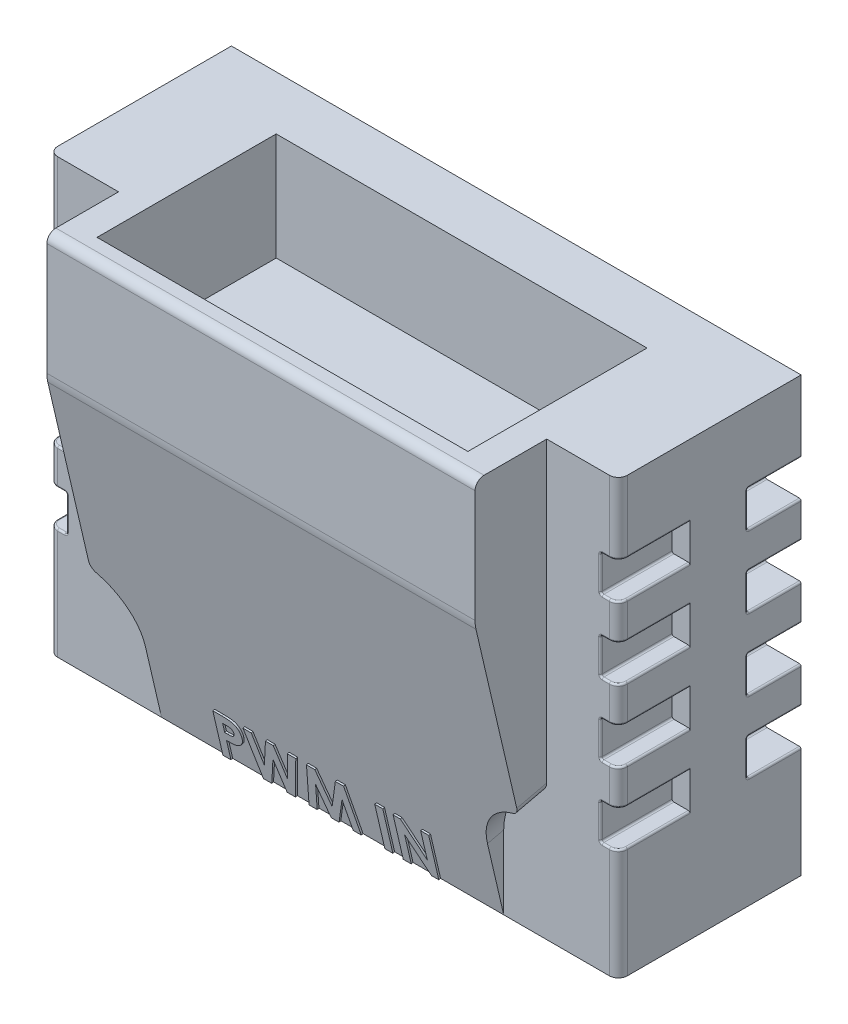
from build123d import *

# Parameters (mm, degrees)
SKETCH1_W           = 31.8
SKETCH1_H           = 24.2
BOSS_EXTRUDE1_DEPTH = 5.1
BOSS_EXTRUDE2_START = -4
BOSS_EXTRUDE2_DEPTH = 23.9
FILLET1_R           = 2
FILLET2_R           = 0.5
CUT_EXTRUDE1_REACH  = 26.566
FILLET4_R           = 0.5
SKETCH5_W           = 1
SKETCH5_H           = 2
CUT_EXTRUDE2_DEPTH  = 4
FILLET5_R           = 0.5
FILLET6_R           = 0.1
FILLET7_R           = 0.1
SKETCH6_W           = 20.7
SKETCH6_H           = 10
CUT_EXTRUDE3_DEPTH  = 6
SKETCH7_W           = 2
SKETCH7_H           = 2
CUT_EXTRUDE4_DEPTH  = 3
FILLET8_R           = 0.1
SKETCH9_W           = 16.6
SKETCH9_H           = 4.4
CUT_EXTRUDE5_DEPTH  = 3
SKETCH10_W          = 0.448717949
SKETCH10_H          = 2.5
BOSS_EXTRUDE3_DEPTH = 0.1


with BuildPart() as part:
    # Sketch1 → Boss-Extrude1 (new, symmetric)
    with BuildSketch(Plane.XY):
        Rectangle(SKETCH1_W, SKETCH1_H)
    extrude(amount=BOSS_EXTRUDE1_DEPTH, both=True)

    # Sketch3 → Boss-Extrude2 (add)
    with BuildSketch(Plane(origin=(15.9, 0, 0), x_dir=(0, 0, -1), z_dir=(1, 0, 0)).offset(BOSS_EXTRUDE2_START)):
        Polygon((-5.1, -12.1), (-5.798193173, -9.097769357), (-9.1, 5.1), (-9.1, 12.1), (-5.1, 12.1), align=None)
    extrude(amount=-BOSS_EXTRUDE2_DEPTH)

    # Fillet1
    fillet1_edges = [part.edges().sort_by_distance(p)[0] for p in [
        (-0.05, 5.1, 9.1),
    ]]
    fillet(fillet1_edges, radius=FILLET1_R)

    # Fillet2
    fillet2_edges = [part.edges().sort_by_distance(p)[0] for p in [
        (-0.05, 12.1, 9.1),
    ]]
    fillet(fillet2_edges, radius=FILLET2_R)

    # Cut-Extrude1: up to this face of the body (flat: up to its plane)
    cut_extrude1_end = Plane(part.part.faces().sort_by_distance((-13.95, 0, 5.1))[0])
    # Sketch4 → Cut-Extrude1 (cut, up to the picked face)
    with BuildSketch(Plane(origin=(0, -1.746023602, 7.507901488), x_dir=(1, 0, 0), z_dir=(0, -0.22651349466027812, 0.9740080270391966)), mode=Mode.PRIVATE) as cut_extrude1_sk1:
        with BuildLine():
            Line((-9.6, -6.630278304), (-9.6, -10.630278304))
            Line((-9.6, -10.630278304), (-12, -10.630278304))
            Line((-12, -10.630278304), (-12, -3.630278304))
            ThreePointArc((-12, -3.630278304), (-10.273828411, -4.709341033), (-9.6, -6.630278304))
        make_face()
    cut_extrude1_tool1 = split(extrude(cut_extrude1_sk1.sketch, amount=-CUT_EXTRUDE1_REACH, mode=Mode.PRIVATE), bisect_by=cut_extrude1_end, keep=Keep.BOTH, mode=Mode.PRIVATE)
    # Sketch4 → Cut-Extrude1 (cut, up to the picked face)
    with BuildSketch(Plane(origin=(0, -1.746023602, 7.507901488), x_dir=(1, 0, 0), z_dir=(0, -0.22651349466027812, 0.9740080270391966)), mode=Mode.PRIVATE) as cut_extrude1_sk2:
        with BuildLine():
            Line((9.5, -6.630278304), (9.5, -10.630278304))
            Line((9.5, -10.630278304), (11.9, -10.630278304))
            Line((11.9, -10.630278304), (11.9, -3.630278304))
            ThreePointArc((11.9, -3.630278304), (10.173828411, -4.709341033), (9.5, -6.630278304))
        make_face()
    cut_extrude1_tool2 = split(extrude(cut_extrude1_sk2.sketch, amount=-CUT_EXTRUDE1_REACH, mode=Mode.PRIVATE), bisect_by=cut_extrude1_end, keep=Keep.BOTH, mode=Mode.PRIVATE)
    add(cut_extrude1_tool1.solids().sort_by(Axis((-10.871103, -9.027029, 5.814644), (0, 0.22651349466027812, -0.9740080270391966)))[0], mode=Mode.SUBTRACT)
    add(cut_extrude1_tool2.solids().sort_by(Axis((10.771103, -9.027029, 5.814644), (0, 0.22651349466027812, -0.9740080270391966)))[0], mode=Mode.SUBTRACT)

    # Fillet4
    fillet4_edges = [part.edges().sort_by_distance(p)[0] for p in [
        (11.9, -5.097572362, 5.892797231),
        (-12, -5.097572362, 5.892797231),
    ]]
    fillet(fillet4_edges, radius=FILLET4_R)

    # Sketch5 → Cut-Extrude2 (cut)
    with BuildSketch(Plane.XY.offset(5.1)):
        with Locations((-15.4, -0.9)):
            Rectangle(SKETCH5_W, SKETCH5_H)
        with Locations((-15.4, -4.9)):
            Rectangle(SKETCH5_W, SKETCH5_H)
        with Locations((-15.4, 7.1)):
            Rectangle(SKETCH5_W, SKETCH5_H)
        with Locations((15.4, 7.1)):
            Rectangle(SKETCH5_W, SKETCH5_H)
        with Locations((15.4, 3.1)):
            Rectangle(SKETCH5_W, SKETCH5_H)
        with Locations((15.4, -0.9)):
            Rectangle(SKETCH5_W, SKETCH5_H)
        with Locations((15.4, -4.9)):
            Rectangle(SKETCH5_W, SKETCH5_H)
        with Locations((-15.4, 3.1)):
            Rectangle(SKETCH5_W, SKETCH5_H)
    extrude(amount=-CUT_EXTRUDE2_DEPTH, mode=Mode.SUBTRACT)

    # Fillet5
    fillet5_edges = [part.edges().sort_by_distance(p)[0] for p in [
        (15.9, -9, 5.1),
        (-15.9, 10.1, 5.1),
        (15.9, -2.9, 5.1),
        (15.9, 1.1, 5.1),
        (15.9, 5.1, 5.1),
        (15.9, 10.1, 5.1),
        (-15.9, 5.1, 5.1),
        (-15.9, 1.1, 5.1),
        (-15.9, -2.9, 5.1),
        (-15.9, -9, 5.1),
    ]]
    fillet(fillet5_edges, radius=FILLET5_R)

    # Fillet6
    fillet6_edges = [part.edges().sort_by_distance(p)[0] for p in [
        (14.9, 8.1, 3.1),
        (15.9, 8.1, 2.85),
        (15.9, 6.1, 2.85),
        (14.9, 6.1, 3.1),
        (14.9, 7.1, 5.1),
        (14.9, 4.1, 3.1),
        (15.9, 4.1, 2.85),
        (15.9, 2.1, 2.85),
        (14.9, 2.1, 3.1),
        (14.9, 3.1, 5.1),
        (14.9, 0.1, 3.1),
        (15.9, 0.1, 2.85),
        (15.9, -1.9, 2.85),
        (14.9, -1.9, 3.1),
        (14.9, -0.9, 5.1),
        (14.9, -3.9, 3.1),
        (15.9, -3.9, 2.85),
        (15.9, -5.9, 2.85),
        (14.9, -5.9, 3.1),
        (14.9, -4.9, 5.1),
        (15.15, 8.1, 5.1),
        (15.15, -5.9, 5.1),
        (15.15, -3.9, 5.1),
        (15.15, -1.9, 5.1),
        (15.15, 0.1, 5.1),
        (15.15, 2.1, 5.1),
        (15.15, 4.1, 5.1),
        (15.15, 6.1, 5.1),
        (15.753553391, -5.9, 4.953553391),
        (15.753553391, -1.9, 4.953553391),
        (15.753553391, -3.9, 4.953553391),
        (15.753553391, 2.1, 4.953553391),
        (15.753553391, 0.1, 4.953553391),
        (15.753553391, 6.1, 4.953553391),
        (15.753553391, 4.1, 4.953553391),
        (15.753553391, 8.1, 4.953553391),
    ]]
    fillet(fillet6_edges, radius=FILLET6_R)

    # Fillet7
    fillet7_edges = [part.edges().sort_by_distance(p)[0] for p in [
        (-15.9, -3.9, 2.85),
        (-14.9, -4.9, 5.1),
        (-14.9, -3.9, 3.1),
        (-14.9, -5.9, 3.1),
        (-15.9, -5.9, 2.85),
        (-15.9, 8.1, 2.85),
        (-14.9, 7.1, 5.1),
        (-14.9, 8.1, 3.1),
        (-14.9, 6.1, 3.1),
        (-15.9, 6.1, 2.85),
        (-15.9, 4.1, 2.85),
        (-14.9, 3.1, 5.1),
        (-14.9, 4.1, 3.1),
        (-14.9, 2.1, 3.1),
        (-15.9, 2.1, 2.85),
        (-15.9, 0.1, 2.85),
        (-14.9, -0.9, 5.1),
        (-14.9, 0.1, 3.1),
        (-14.9, -1.9, 3.1),
        (-15.9, -1.9, 2.85),
        (-15.15, -3.9, 5.1),
        (-15.15, -5.9, 5.1),
        (-15.15, 8.1, 5.1),
        (-15.15, 6.1, 5.1),
        (-15.15, 4.1, 5.1),
        (-15.15, 2.1, 5.1),
        (-15.15, 0.1, 5.1),
        (-15.15, -1.9, 5.1),
        (-15.753553391, -5.9, 4.953553391),
        (-15.753553391, -3.9, 4.953553391),
        (-15.753553391, -1.9, 4.953553391),
        (-15.753553391, 0.1, 4.953553391),
        (-15.753553391, 2.1, 4.953553391),
        (-15.753553391, 4.1, 4.953553391),
        (-15.753553391, 6.1, 4.953553391),
        (-15.753553391, 8.1, 4.953553391),
    ]]
    fillet(fillet7_edges, radius=FILLET7_R)

    # Sketch6 → Cut-Extrude3 (cut)
    with BuildSketch(Plane(origin=(0, 12.1, 0), x_dir=(1, 0, 0), z_dir=(0, 1, 0))):
        with Locations((-0.05, -2.9)):
            Rectangle(SKETCH6_W, SKETCH6_H)
    extrude(amount=-CUT_EXTRUDE3_DEPTH, mode=Mode.SUBTRACT)

    # Sketch7 → Cut-Extrude4 (cut)
    with BuildSketch(Plane(origin=(0, 0, -5.1), x_dir=(-1, 0, 0), z_dir=(0, 0, -1))):
        with Locations((-14.9, 7.1)):
            Rectangle(SKETCH7_W, SKETCH7_H)
        with Locations((-14.9, 3.1)):
            Rectangle(SKETCH7_W, SKETCH7_H)
        with Locations((-14.9, -0.9)):
            Rectangle(SKETCH7_W, SKETCH7_H)
        with Locations((-14.9, -4.9)):
            Rectangle(SKETCH7_W, SKETCH7_H)
        with Locations((14.9, -4.9)):
            Rectangle(SKETCH7_W, SKETCH7_H)
        with Locations((14.9, -0.9)):
            Rectangle(SKETCH7_W, SKETCH7_H)
        with Locations((14.9, 3.1)):
            Rectangle(SKETCH7_W, SKETCH7_H)
        with Locations((14.9, 7.1)):
            Rectangle(SKETCH7_W, SKETCH7_H)
    extrude(amount=-CUT_EXTRUDE4_DEPTH, mode=Mode.SUBTRACT)

    # Fillet8
    fillet8_edges = [part.edges().sort_by_distance(p)[0] for p in [
        (15.9, 3.1, -2.1),
        (15.9, 2.1, -3.6),
        (14.9, 4.1, -2.1),
        (15.9, 4.1, -3.6),
        (13.9, 4.1, -3.6),
        (14.9, 2.1, -2.1),
        (13.9, 2.1, -3.6),
        (15.9, -0.9, -2.1),
        (15.9, -1.9, -3.6),
        (14.9, 0.1, -2.1),
        (15.9, 0.1, -3.6),
        (13.9, 0.1, -3.6),
        (14.9, -1.9, -2.1),
        (13.9, -1.9, -3.6),
        (15.9, -4.9, -2.1),
        (15.9, -5.9, -3.6),
        (14.9, -3.9, -2.1),
        (15.9, -3.9, -3.6),
        (13.9, -3.9, -3.6),
        (14.9, -5.9, -2.1),
        (13.9, -5.9, -3.6),
        (-15.9, -4.9, -2.1),
        (-15.9, -3.9, -3.6),
        (-14.9, -5.9, -2.1),
        (-15.9, -5.9, -3.6),
        (-13.9, -5.9, -3.6),
        (-14.9, -3.9, -2.1),
        (-13.9, -3.9, -3.6),
        (-15.9, -0.9, -2.1),
        (-15.9, 0.1, -3.6),
        (-14.9, -1.9, -2.1),
        (-15.9, -1.9, -3.6),
        (-13.9, -1.9, -3.6),
        (-14.9, 0.1, -2.1),
        (-13.9, 0.1, -3.6),
        (-15.9, 3.1, -2.1),
        (-15.9, 4.1, -3.6),
        (-14.9, 2.1, -2.1),
        (-15.9, 2.1, -3.6),
        (-13.9, 2.1, -3.6),
        (-14.9, 4.1, -2.1),
        (-13.9, 4.1, -3.6),
        (-15.9, 7.1, -2.1),
        (-15.9, 8.1, -3.6),
        (-14.9, 6.1, -2.1),
        (-15.9, 6.1, -3.6),
        (-13.9, 6.1, -3.6),
        (-14.9, 8.1, -2.1),
        (-13.9, 8.1, -3.6),
        (15.9, 7.1, -2.1),
        (15.9, 6.1, -3.6),
        (14.9, 8.1, -2.1),
        (15.9, 8.1, -3.6),
        (13.9, 8.1, -3.6),
        (14.9, 6.1, -2.1),
        (13.9, 6.1, -3.6),
    ]]
    fillet(fillet8_edges, radius=FILLET8_R)

    # Sketch9 → Cut-Extrude5 (cut)
    with BuildSketch(Plane.XZ.offset(12.1)):
        with Locations((0, 1.6)):
            Rectangle(SKETCH9_W, SKETCH9_H)
    extrude(amount=-CUT_EXTRUDE5_DEPTH, mode=Mode.SUBTRACT)

    # Sketch10 → Boss-Extrude3 (add)
    # profile 1 of 5: a face of its own
    with BuildSketch(Plane(origin=(0, -1.746023602, 7.507901488), x_dir=(1, 0, 0), z_dir=(0, -0.22651349466027812, 0.9740080270391966))):
        with BuildLine():
            Line((-6.075641026, -8.130278304), (-5.574839744, -8.130278304))
            add(Edge.make_bspline(
                [(-5.574839744, -8.130278304), (-5.542118038, -8.130424774), (-5.478991008, -8.130707344), (-5.387956637, -8.134133881), (-5.303972972, -8.140274445), (-5.227059309, -8.147863211), (-5.157247273, -8.158502365), (-5.094449438, -8.170699322), (-5.038652771, -8.185558766), (-4.989228084, -8.20319672), (-4.944871023, -8.223991178), (-4.902894937, -8.246138761), (-4.864248489, -8.272571119), (-4.826981078, -8.300439487), (-4.793223346, -8.332406118), (-4.760869282, -8.366343586), (-4.731289169, -8.403597823), (-4.704345945, -8.443717878), (-4.679904289, -8.485962503), (-4.658550423, -8.530407219), (-4.641229363, -8.577122354), (-4.626699148, -8.625805716), (-4.615028337, -8.676455182), (-4.607259874, -8.729382252), (-4.601983143, -8.784217368), (-4.601517544, -8.821538182), (-4.601282051, -8.840414522)],
                knots=[0, 0, 0, 0, 1.698747864, 3.27724071, 4.728299578, 6.070144658, 7.288476769, 8.393259625, 9.389771311, 10.283485332, 11.113357557, 11.931608583, 12.74405601, 13.541433047, 14.344816069, 15.154114104, 15.974336324, 16.810834471, 17.661136416, 18.50621059, 19.367396281, 20.244825668, 21.142564693, 22.063065223, 23.020325768, 24, 24, 24, 24], degree=3))
            add(Edge.make_bspline(
                [(-4.601282051, -8.840414522), (-4.60162278, -8.861296968), (-4.602292355, -8.902333541), (-4.608856345, -8.962488121), (-4.620069715, -9.019840067), (-4.634725002, -9.074873038), (-4.655160757, -9.12668162), (-4.678507648, -9.176501981), (-4.707231729, -9.222937311), (-4.740053584, -9.26656846), (-4.775898794, -9.307750171), (-4.815618323, -9.345293398), (-4.8584551, -9.379454074), (-4.904161157, -9.410590204), (-4.952908089, -9.43863898), (-5.004660723, -9.463863049), (-5.059772455, -9.485455667), (-5.098150607, -9.496748432), (-5.117608173, -9.502473817)],
                knots=[0, 0, 0, 0, 1.102006807, 2.165578795, 3.188629044, 4.184801286, 5.166646146, 6.124351954, 7.085497154, 8.042432466, 9.003981491, 9.963833307, 10.922997304, 11.89326795, 12.880200226, 13.889073926, 14.929769137, 16, 16, 16, 16], degree=3))
            add(Edge.make_bspline(
                [(-5.117608173, -9.502473817), (-5.130424045, -9.505662427), (-5.158187351, -9.512569982), (-5.204127997, -9.519582885), (-5.257069767, -9.526030818), (-5.317183858, -9.531572035), (-5.384504926, -9.535338772), (-5.458967788, -9.538280426), (-5.540606188, -9.540419312), (-5.597374303, -9.540495209), (-5.626923077, -9.540534715)],
                knots=[0, 0, 0, 0, 0.618981996, 1.340914327, 2.176866532, 3.120127938, 4.170906482, 5.338178032, 6.614476169, 8, 8, 8, 8], degree=3))
            Line((-5.626923077, -9.540534715), (-5.626923077, -10.630278304))
            Line((-5.626923077, -10.630278304), (-6.075641026, -10.630278304))
            Line((-6.075641026, -10.630278304), (-6.075641026, -8.130278304))
        make_face()
        with BuildLine():
            Line((-5.626923077, -9.091816766), (-5.468169071, -9.091816766))
            add(Edge.make_bspline(
                [(-5.468169071, -9.091816766), (-5.439281273, -9.091633595), (-5.386127296, -9.091296557), (-5.313537733, -9.0864228), (-5.255203364, -9.078979587), (-5.20911813, -9.068304299), (-5.172729472, -9.052103136), (-5.141346533, -9.033361441), (-5.114428585, -9.009663082), (-5.091121604, -8.982583652), (-5.072488375, -8.951468029), (-5.059567201, -8.916822872), (-5.051173861, -8.879376112), (-5.050398658, -8.853315646), (-5.05, -8.839913721)],
                knots=[0, 0, 0, 0, 1.8619151, 3.425951444, 4.686033666, 5.651700536, 6.461346321, 7.243864085, 7.999046032, 8.762387399, 9.539336099, 10.322741239, 11.137448474, 12, 12, 12, 12], degree=3))
            add(Edge.make_bspline(
                [(-5.05, -8.839913721), (-5.050394557, -8.828204634), (-5.051160093, -8.805486191), (-5.056783927, -8.772697841), (-5.065746701, -8.742132336), (-5.078733417, -8.71410889), (-5.095522164, -8.688675121), (-5.115991045, -8.665841048), (-5.139877403, -8.645117659), (-5.158319068, -8.634148453), (-5.167688301, -8.62857558)],
                knots=[0, 0, 0, 0, 1.102301479, 2.1387299, 3.123554645, 4.094223062, 5.036071848, 5.982632524, 6.975082478, 8, 8, 8, 8], degree=3))
            add(Edge.make_bspline(
                [(-5.167688301, -8.62857558), (-5.175624582, -8.624561975), (-5.192427316, -8.616064351), (-5.221044, -8.606185242), (-5.254067216, -8.597851125), (-5.291719908, -8.590933888), (-5.33385187, -8.585565394), (-5.380455583, -8.581459839), (-5.43159963, -8.579808836), (-5.467167254, -8.579274585), (-5.485697115, -8.578996253)],
                knots=[0, 0, 0, 0, 0.656809284, 1.390599849, 2.23162475, 3.173112763, 4.218524733, 5.370385145, 6.63003504, 8, 8, 8, 8], degree=3))
            Line((-5.485697115, -8.578996253), (-5.626923077, -8.578996253))
            Line((-5.626923077, -8.578996253), (-5.626923077, -9.091816766))
        make_face(mode=Mode.SUBTRACT)
    # profile 2 of 5: a face of its own
    with BuildSketch(Plane(origin=(0, -1.746023602, 7.507901488), x_dir=(1, 0, 0), z_dir=(0, -0.22651349466027812, 0.9740080270391966))):
        Polygon((-4.392948718, -8.130278304), (-3.929707532, -8.130278304), (-3.559615385, -9.72633199), (-3.135436699, -8.130278304), (-2.700240385, -8.130278304), (-2.277564103, -9.72633199), (-1.90947516, -8.130278304), (-1.444230769, -8.130278304), (-2.022155449, -10.630278304), (-2.490905449, -10.630278304), (-2.918589744, -9.014192567), (-3.348277244, -10.630278304), (-3.813521635, -10.630278304), align=None)
    # profile 3 of 5: a face of its own
    with BuildSketch(Plane(origin=(0, -1.746023602, 7.507901488), x_dir=(1, 0, 0), z_dir=(0, -0.22651349466027812, 0.9740080270391966))):
        Polygon((-0.845773237, -8.130278304), (-0.381029647, -8.130278304), (0.190384615, -9.874068369), (0.764803686, -8.130278304), (1.226041667, -8.130278304), (1.648717949, -10.630278304), (1.194491186, -10.630278304), (0.927564103, -9.051251862), (0.407732372, -10.630278304), (-0.029467147, -10.630278304), (-0.546794872, -9.051251862), (-0.813221154, -10.630278304), (-1.267948718, -10.630278304), align=None)
    # profile 4 of 5: a face of its own
    with BuildSketch(Plane(origin=(0, -1.746023602, 7.507901488), x_dir=(1, 0, 0), z_dir=(0, -0.22651349466027812, 0.9740080270391966))):
        with Locations((3.187179487, -9.380278304)):
            Rectangle(SKETCH10_W, SKETCH10_H)
    # profile 5 of 5: a face of its own
    with BuildSketch(Plane(origin=(0, -1.746023602, 7.507901488), x_dir=(1, 0, 0), z_dir=(0, -0.22651349466027812, 0.9740080270391966))):
        Polygon((3.988461538, -8.130278304), (4.392608173, -8.130278304), (5.526923077, -9.775410516), (5.526923077, -8.130278304), (5.975641026, -8.130278304), (5.975641026, -10.630278304), (5.568489583, -10.630278304), (4.437179487, -8.990154106), (4.437179487, -10.630278304), (3.988461538, -10.630278304), align=None)
    extrude(amount=BOSS_EXTRUDE3_DEPTH)


solid = part.part
